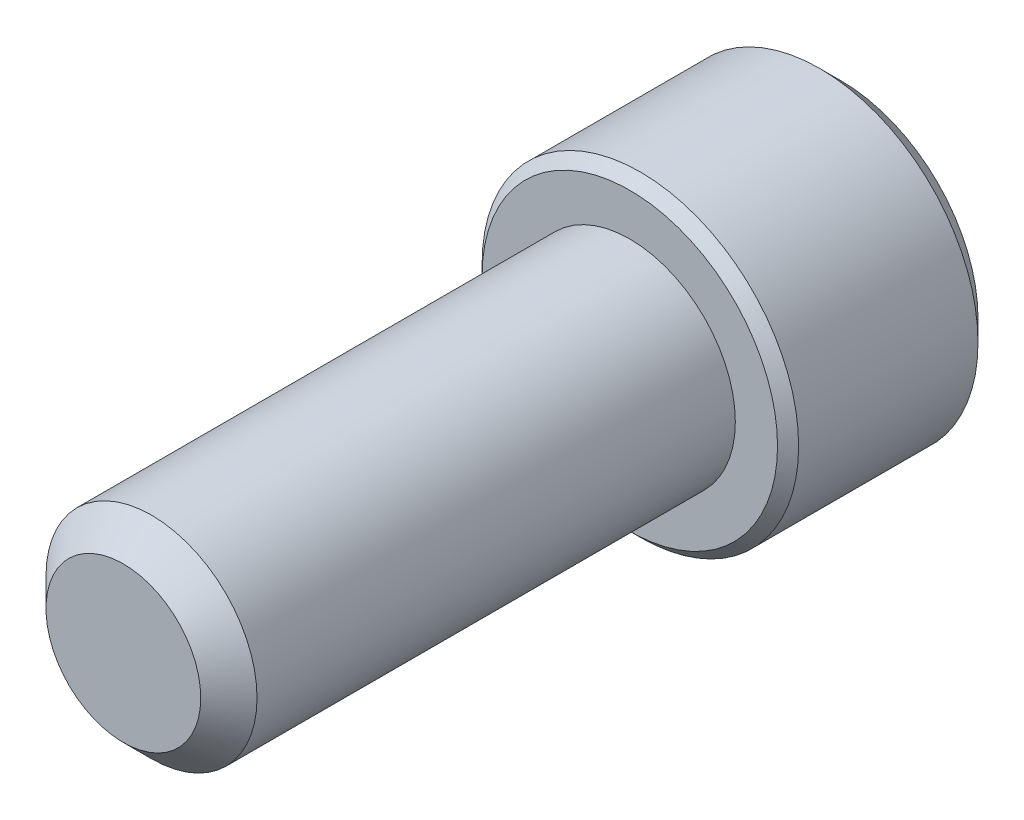
from build123d import *

# Parameters (mm, degrees)
SKETCH1_R          = 3.96875
EXTRUDE1_DEPTH     = 19.05
CHAMFER3_SIZE      = 1.058333333
SKETCH6_R          = 5.953125
EXTRUDE2_DEPTH     = 7.9375
CUT_EXTRUDE1_DEPTH = 4.7625
SKETCH8_R          = 3.666174209
CUT_EXTRUDE2_DEPTH = 0.79375
CUT_EXTRUDE2_DRAFT = -45
CHAMFER1_SIZE      = 0.79375
CHAMFER2_SIZE      = 0.396875


with BuildPart() as part:
    # Sketch1 → Extrude1 (new body)
    with BuildSketch(Plane.XY):
        Circle(SKETCH1_R)
    extrude(amount=-EXTRUDE1_DEPTH)

    # Chamfer3
    chamfer3_edges = [part.edges().sort_by_distance(p)[0] for p in [
        (-3.96875, 0, 0),
    ]]
    chamfer(chamfer3_edges, length=CHAMFER3_SIZE)

    # Sketch6 → Extrude2 (add)
    with BuildSketch(Plane(origin=(0, 0, -19.05), x_dir=(-1, 0, 0), z_dir=(0, 0, -1))):
        Circle(SKETCH6_R)
    extrude(amount=EXTRUDE2_DEPTH)

    # Sketch7 → Cut-Extrude1 (cut)
    with BuildSketch(Plane(origin=(0, 0, -26.9875), x_dir=(-1, 0, 0), z_dir=(0, 0, -1))):
        Polygon((0, 3.666174209), (-3.175, 1.833087105), (-3.175, -1.833087105), (0, -3.666174209), (3.175, -1.833087105), (3.175, 1.833087105), align=None)
    extrude(amount=-CUT_EXTRUDE1_DEPTH, mode=Mode.SUBTRACT)


with BuildPart() as cut_extrude2_tool:
    # Sketch8 → Cut-Extrude2 (with draft: the straight prism first)
    with BuildSketch(Plane(origin=(0, 0, -26.9875), x_dir=(-1, 0, 0), z_dir=(0, 0, -1))):
        Circle(SKETCH8_R)
    extrude(amount=-CUT_EXTRUDE2_DEPTH)
    # Cut-Extrude2: the draft: its side faces are tilted about the plane it starts from
    cut_extrude2_sides = [cut_extrude2_tool.faces().sort_by_distance(p)[0] for p in [
        (3.666174209, 0, -26.590625),
    ]]
    draft(cut_extrude2_sides, Plane(origin=(0, 0, -26.9875), x_dir=(-1, 0, 0), z_dir=(0, 0, -1)), CUT_EXTRUDE2_DRAFT)


with BuildPart() as part_1:
    add(part.part)

    # Cut-Extrude2: cut by cut_extrude2_tool
    add(cut_extrude2_tool.part, mode=Mode.SUBTRACT)

    # Chamfer1
    chamfer1_edges = [part_1.edges().sort_by_distance(p)[0] for p in [
        (5.953125, 0, -26.9875),
    ]]
    chamfer(chamfer1_edges, length=CHAMFER1_SIZE)

    # Chamfer2
    chamfer2_edges = [part_1.edges().sort_by_distance(p)[0] for p in [
        (5.953125, 0, -19.05),
    ]]
    chamfer(chamfer2_edges, length=CHAMFER2_SIZE)


solid = part_1.part
